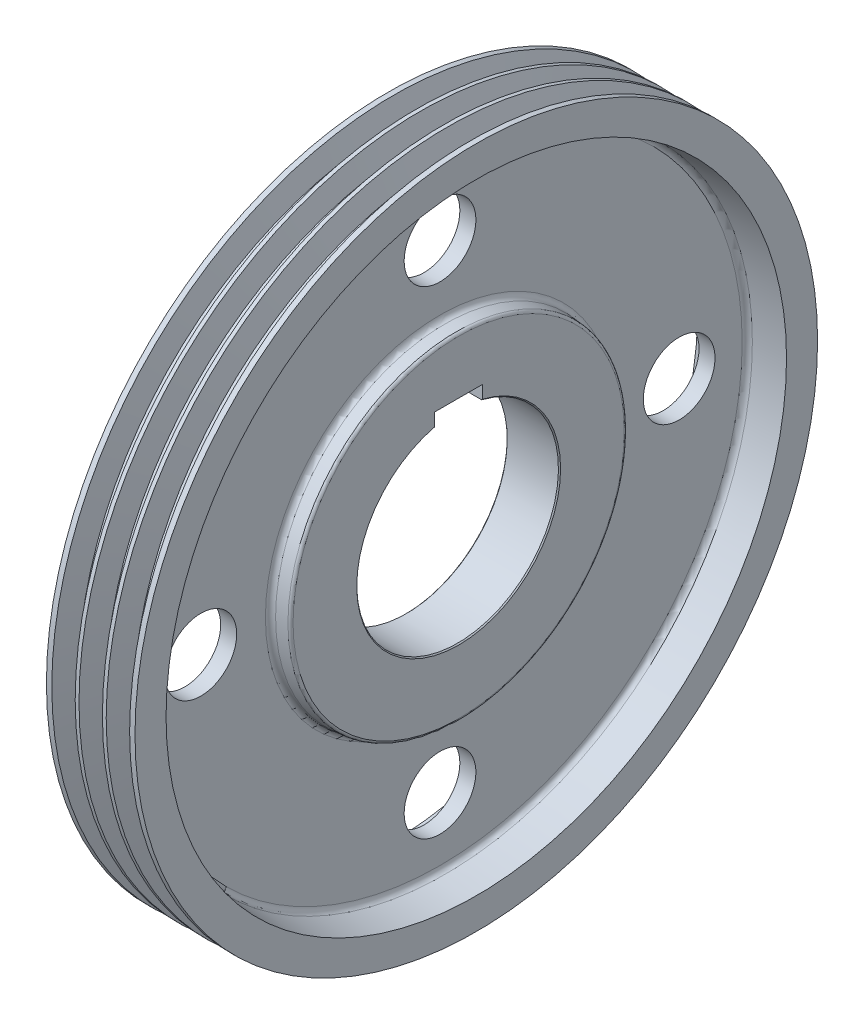
from build123d import *

# Parameters (mm, degrees)
PATTERN_LINEAR_1001_COUNT   = 3
PATTERN_LINEAR_1001_PITCH   = 25.5
CHAMFER_1_SIZE              = 1
SKETCH_4_W                  = 45
SKETCH_4_H                  = 13.117648374
CUT_EXTRUDE_1_DEPTH         = 458.128351779
FILLET_1_R                  = 5
FILLET_2_R                  = 2.5
SKETCH_5_R                  = 33.6
CUT_EXTRUDE_2_DEPTH         = 460.818529422
PATTERN_CIRCULAR_1915_COUNT = 4


with BuildPart() as part:
    # 草图1 → 旋转1 (revolve)
    with BuildSketch(Plane.XY, mode=Mode.PRIVATE) as revolve_1_sk:
        Polygon((16.5, 94.5), (16.5, 157.5), (34, 159.031051612), (34, 287.72538544), (0, 290.7), (0, 319.8), (83, 319.8), (83, 290.7), (49, 287.72538544), (49, 159.031051612), (66.5, 157.5), (66.5, 94.5), align=None)
    revolve(revolve_1_sk.sketch.rotate(Axis((0, 0, 0), (1, 0, 0)), 90), axis=Axis((0, 0, 0), (1, 0, 0)))

    # 草图2 → 切除-旋转1 (revolve, cut)
    with BuildSketch(Plane.XY, mode=Mode.PRIVATE) as cut_revolve_1_sk:
        Polygon((21.128051255, 300.7), (26.967507271, 319.8), (5.032492729, 319.8), (10.871948745, 300.7), align=None)
    cut_revolve_1 = revolve(cut_revolve_1_sk.sketch.rotate(Axis((0, 0, 0), (1, 0, 0)), 90), axis=Axis((0, 0, 0), (1, 0, 0)), mode=Mode.SUBTRACT)

    # Pattern Linear 1001: 切除-旋转1 ×3
    with Locations(*[(i * PATTERN_LINEAR_1001_PITCH, 0, 0) for i in range(1, PATTERN_LINEAR_1001_COUNT)]):
        add(cut_revolve_1, mode=Mode.SUBTRACT)

    # 倒角1
    chamfer_1_edges = [part.edges().sort_by_distance(p)[0] for p in [
        (16.5, 0, -94.5),
        (66.5, 0, -94.5),
    ]]
    chamfer(chamfer_1_edges, length=CHAMFER_1_SIZE)

    # 草图4 → 切除-拉伸1 (cut, through all)
    with BuildSketch(Plane.ZY.offset(-16.5)):
        with Locations((0, 98.341175432)):
            Rectangle(SKETCH_4_W, SKETCH_4_H)
    extrude(amount=-CUT_EXTRUDE_1_DEPTH, mode=Mode.SUBTRACT)

    # 圆角1
    fillet_1_edges = [part.edges().sort_by_distance(p)[0] for p in [
        (34, 0, -287.72538544),
        (34, 0, -159.031051612),
        (49, 0, -159.031051612),
        (49, 0, -287.72538544),
    ]]
    fillet(fillet_1_edges, radius=FILLET_1_R)

    # 圆角2
    fillet_2_edges = [part.edges().sort_by_distance(p)[0] for p in [
        (16.5, 0, -157.5),
        (66.5, 0, -157.5),
    ]]
    fillet(fillet_2_edges, radius=FILLET_2_R)

    # 草图5 → 切除-拉伸2 (cut, through all)
    with BuildSketch(Plane(origin=(0, 0, 0), x_dir=(0, 0, -1), z_dir=(1, 0, 0))):
        with Locations(Location((0, 224.1, 0), (0, 0, 180))):
            Circle(SKETCH_5_R)
    cut_extrude_2 = extrude(amount=CUT_EXTRUDE_2_DEPTH, mode=Mode.SUBTRACT)

    # Pattern Circular 1915: 切除-拉伸2 ×4 about axis
    pattern_circular_1915_axis = Axis((0, 0, 0), (1, 0, 0))
    for i in range(1, PATTERN_CIRCULAR_1915_COUNT):
        add(cut_extrude_2.rotate(pattern_circular_1915_axis, i * 360 / PATTERN_CIRCULAR_1915_COUNT), mode=Mode.SUBTRACT)


solid = part.part
